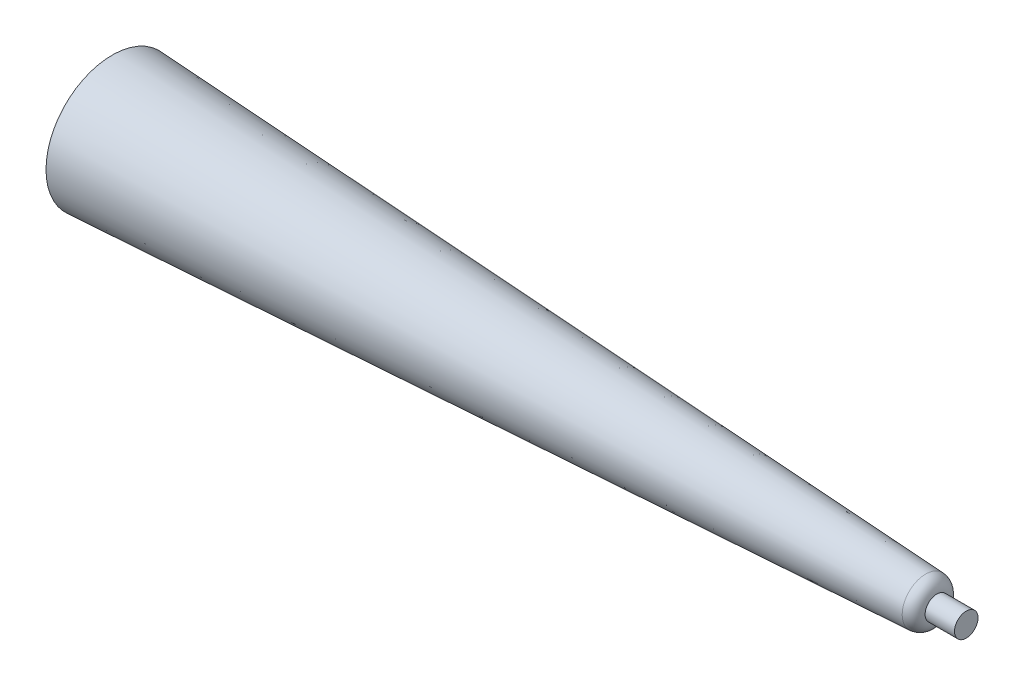
from build123d import *


with BuildPart() as part:
    # Sketch4 → Revolve1 (revolve)
    with BuildSketch(Plane.XY, mode=Mode.PRIVATE) as revolve1_sk:
        with BuildLine():
            Line((-54.86728236, -6.146776776), (-17.973710654, -6.146776776))
            Line((-17.973710654, -6.146776776), (-17.973710654, -5.638776776))
            Line((-17.973710654, -5.638776776), (-19.243710654, -5.638776776))
            ThreePointArc((-19.243710654, -5.638776776), (-19.38341193, -5.288612764), (-19.725784654, -5.130776776))
            Line((-19.725784654, -5.130776776), (-54.86728236, -3.289088921))
            Line((-54.86728236, -3.289088921), (-54.86728236, -6.146776776))
        make_face()
    revolve(revolve1_sk.sketch.rotate(Axis((-54.86728236, -6.146776776, 0), (1, 0, 0)), 90), axis=Axis((-54.86728236, -6.146776776, 0), (1, 0, 0)))


solid = part.part
